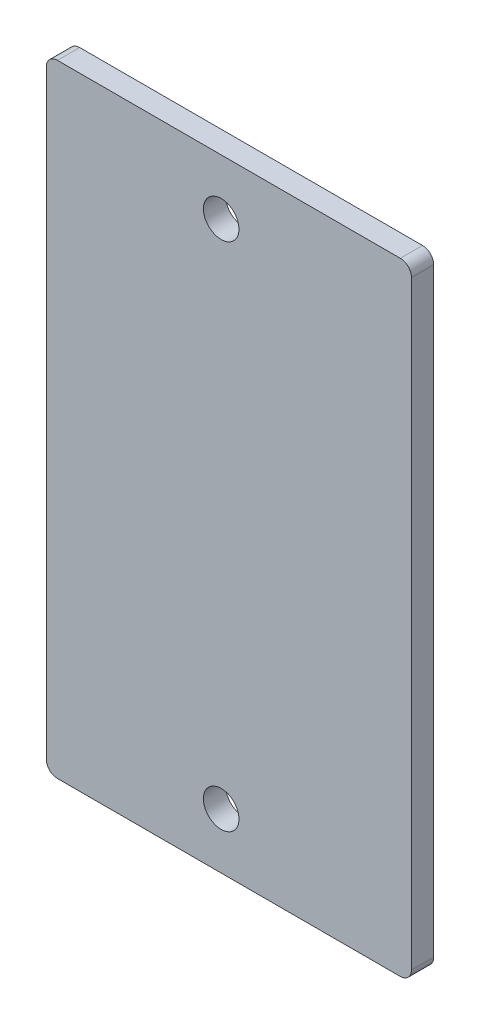
from build123d import *

# Parameters (mm, degrees)
SKETCH_1_R      = 1.6
EXTRUDE_1_DEPTH = 2


with BuildPart() as part:
    # 草图1 → 凸台-拉伸1 (new body)
    with BuildSketch(Plane.XY):
        with BuildLine():
            Line((-65.206418669, -56), (-34.333058664, -56))
            ThreePointArc((-34.333058664, -56), (-33.625951883, -55.707106781), (-33.333058664, -55))
            Line((-33.333058664, -55), (-33.333058664, -1))
            ThreePointArc((-33.333058664, -1), (-33.625951883, -0.292893219), (-34.333058664, 0))
            Line((-34.333058664, 0), (-65.206418669, 0))
            ThreePointArc((-65.206418669, 0), (-65.91352545, -0.292893219), (-66.206418669, -1))
            Line((-66.206418669, -1), (-66.206418669, -55))
            ThreePointArc((-66.206418669, -55), (-65.91352545, -55.707106781), (-65.206418669, -56))
        make_face()
        with Locations((-50.465102199, -5)):
            Circle(SKETCH_1_R, mode=Mode.SUBTRACT)
        with Locations((-50.465102199, -51)):
            Circle(SKETCH_1_R, mode=Mode.SUBTRACT)
    extrude(amount=EXTRUDE_1_DEPTH)


solid = part.part
